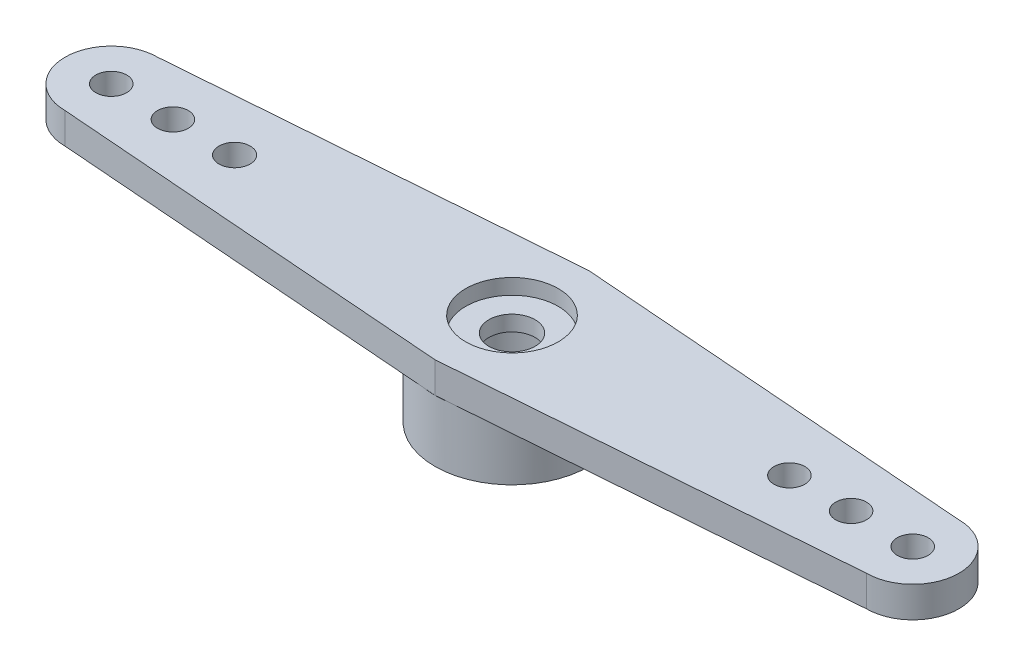
from build123d import *

# Parameters (mm, degrees)
EXTRUDE_2_DEPTH     = 1
SKETCH_2_R          = 2.5
EXTRUDE_3_DEPTH     = 2
SKETCH_3_R          = 1.5
CUT_EXTRUDE_1_DEPTH = 2
SKETCH_4_R          = 0.75
CUT_EXTRUDE_2_DEPTH = 2
CUT_EXTRUDE_START   = 2.5
SKETCH_5_R          = 1.5
CUT_EXTRUDE_3_DEPTH = 2
SKETCH_6_R          = 0.5
SKETCH_6_R_2        = 0.506721332
CUT_EXTRUDE_6_DEPTH = 2


with BuildPart() as part:
    # 草图1 → 凸台-拉伸2 (new body)
    with BuildSketch(Plane(origin=(0, 0, 0), x_dir=(1, 0, 0), z_dir=(0, 1, 0))):
        with BuildLine():
            ThreePointArc((-13, 1.5), (-14.5, 0), (-13, -1.5))
            Line((-13, -1.5), (0, -2.5))
            Line((0, -2.5), (13, -1.5))
            ThreePointArc((13, -1.5), (14.5, 0), (13, 1.5))
            Line((13, 1.5), (0, 2.5))
            Line((0, 2.5), (-13, 1.5))
        make_face()
    extrude(amount=EXTRUDE_2_DEPTH)

    # 草图2 → 凸台-拉伸3 (add)
    with BuildSketch(Plane(origin=(0, 0, 0), x_dir=(1, 0, 0), z_dir=(0, 1, 0))):
        with Locations(Location((0, 0, 0), (0, 0, 270))):
            Circle(SKETCH_2_R)
    extrude(amount=-EXTRUDE_3_DEPTH)

    # 草图3 → 切除-拉伸1 (cut)
    with BuildSketch(Plane(origin=(0, 0, 0), x_dir=(1, 0, 0), z_dir=(0, 1, 0))):
        with Locations(Location((0, 0, 0), (0, 0, 270))):
            Circle(SKETCH_3_R)
    extrude(amount=-CUT_EXTRUDE_1_DEPTH, mode=Mode.SUBTRACT)

    # 草图4 → 切除-拉伸2 (cut)
    with BuildSketch(Plane(origin=(0, 0, 0), x_dir=(1, 0, 0), z_dir=(0, 1, 0))):
        with Locations(Location((0, 0, 0), (0, 0, 270))):
            Circle(SKETCH_4_R)
    extrude(amount=CUT_EXTRUDE_2_DEPTH, mode=Mode.SUBTRACT)

    # 草图5 → 切除-拉伸3 (cut)
    with BuildSketch(Plane(origin=(0, 0, 0), x_dir=(1, 0, 0), z_dir=(0, 1, 0)).offset(CUT_EXTRUDE_START)):
        with Locations(Location((0, 0, 0), (0, 0, 270))):
            Circle(SKETCH_5_R)
    extrude(amount=-CUT_EXTRUDE_3_DEPTH, mode=Mode.SUBTRACT)

    # 草图6 → 切除-拉伸6 (cut)
    with BuildSketch(Plane(origin=(0, 0, 0), x_dir=(1, 0, 0), z_dir=(0, 1, 0))):
        with Locations(Location((13, 0, 0), (0, 0, 270))):
            Circle(SKETCH_6_R)
        with Locations(Location((-13, 0, 0), (0, 0, 270))):
            Circle(SKETCH_6_R)
        with Locations(Location((11, 0, 0), (0, 0, 270))):
            Circle(SKETCH_6_R)
        with Locations(Location((9, 0, 0), (0, 0, 270))):
            Circle(SKETCH_6_R)
        with Locations(Location((-11, 0, 0), (0, 0, 270))):
            Circle(SKETCH_6_R)
        with Locations(Location((-9, 0, 0), (0, 0, 270))):
            Circle(SKETCH_6_R_2)
    extrude(amount=CUT_EXTRUDE_6_DEPTH, mode=Mode.SUBTRACT)


solid = part.part
